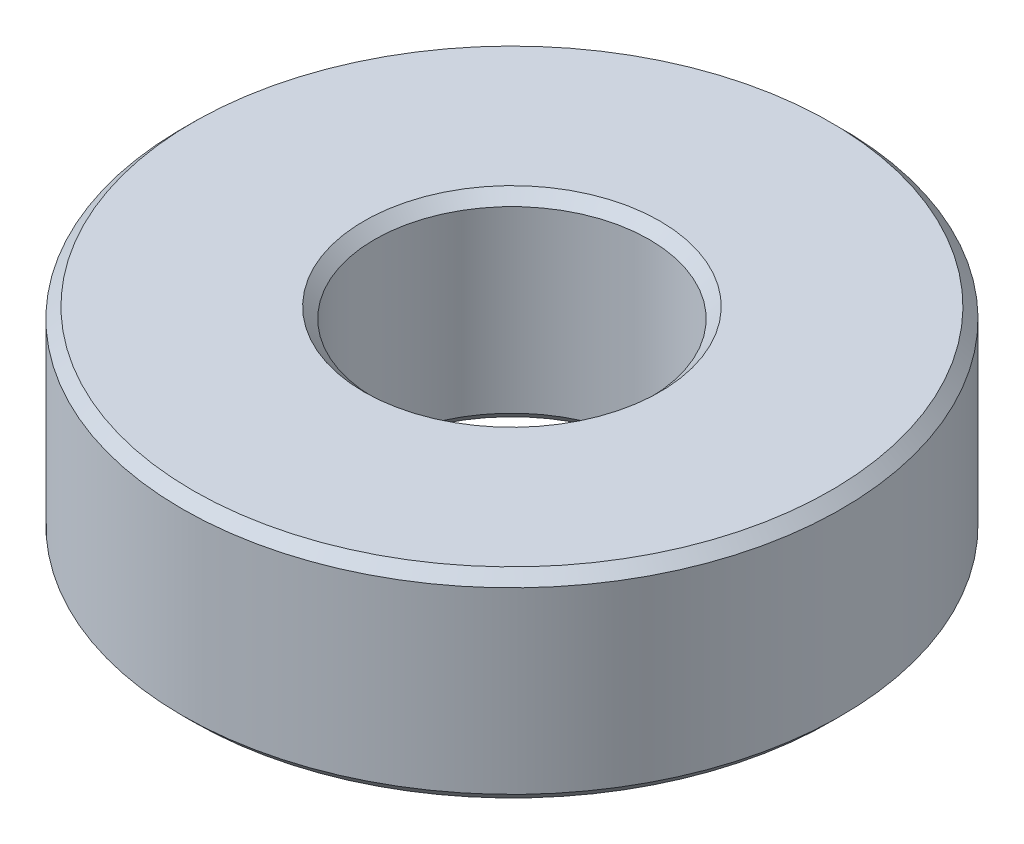
from build123d import *

# Parameters (mm, degrees)
SKETCH1_R           = 7.8613
SKETCH1_R_2         = 3.2766
BOSS_EXTRUDE1_DEPTH = 4.7752
CHAMFER1_SIZE       = 0.254


with BuildPart() as part:
    # Sketch1 → Boss-Extrude1 (new body)
    with BuildSketch(Plane(origin=(0, 0, 0), x_dir=(1, 0, 0), z_dir=(0, 1, 0))):
        with Locations(Location((0, 0, 0), (0, 0, 270))):
            Circle(SKETCH1_R)
        with Locations(Location((0, 0, 0), (0, 0, 270))):
            Circle(SKETCH1_R_2, mode=Mode.SUBTRACT)
    extrude(amount=BOSS_EXTRUDE1_DEPTH)

    # Chamfer1
    chamfer1_edges = [part.edges().sort_by_distance(p)[0] for p in [
        (0, 0, -7.8613),
        (0, 4.7752, -7.8613),
        (0, 0, -3.2766),
        (0, 4.7752, -3.2766),
    ]]
    chamfer(chamfer1_edges, length=CHAMFER1_SIZE)


solid = part.part
